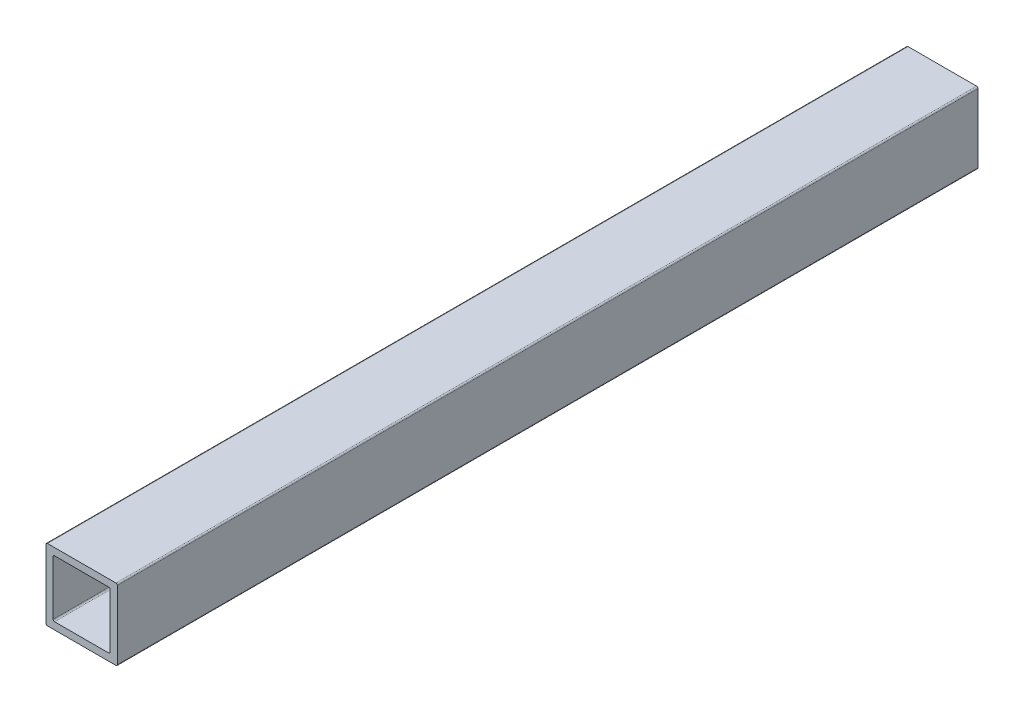
from build123d import *

# Parameters (mm, degrees)
SKETCH_1_W      = 10
SKETCH_1_H      = 10
SKETCH_1_W_2    = 8
SKETCH_1_H_2    = 8
EXTRUDE_1_DEPTH = 120.57
FILLET_1_R      = 0.2


with BuildPart() as part:
    # 草圖1 → 填料-伸長1 (new body)
    with BuildSketch(Plane.XY):
        Rectangle(SKETCH_1_W, SKETCH_1_H)
        Rectangle(SKETCH_1_W_2, SKETCH_1_H_2, mode=Mode.SUBTRACT)
    extrude(amount=EXTRUDE_1_DEPTH)

    # 圓角1
    fillet_1_edges = [part.edges().sort_by_distance(p)[0] for p in [
        (-4, 4, 60.285),
        (-4, -4, 60.285),
        (4, -4, 60.285),
        (4, 4, 60.285),
        (-5, 5, 60.285),
        (5, 5, 60.285),
        (5, -5, 60.285),
        (-5, -5, 60.285),
    ]]
    fillet(fillet_1_edges, radius=FILLET_1_R)


solid = part.part
